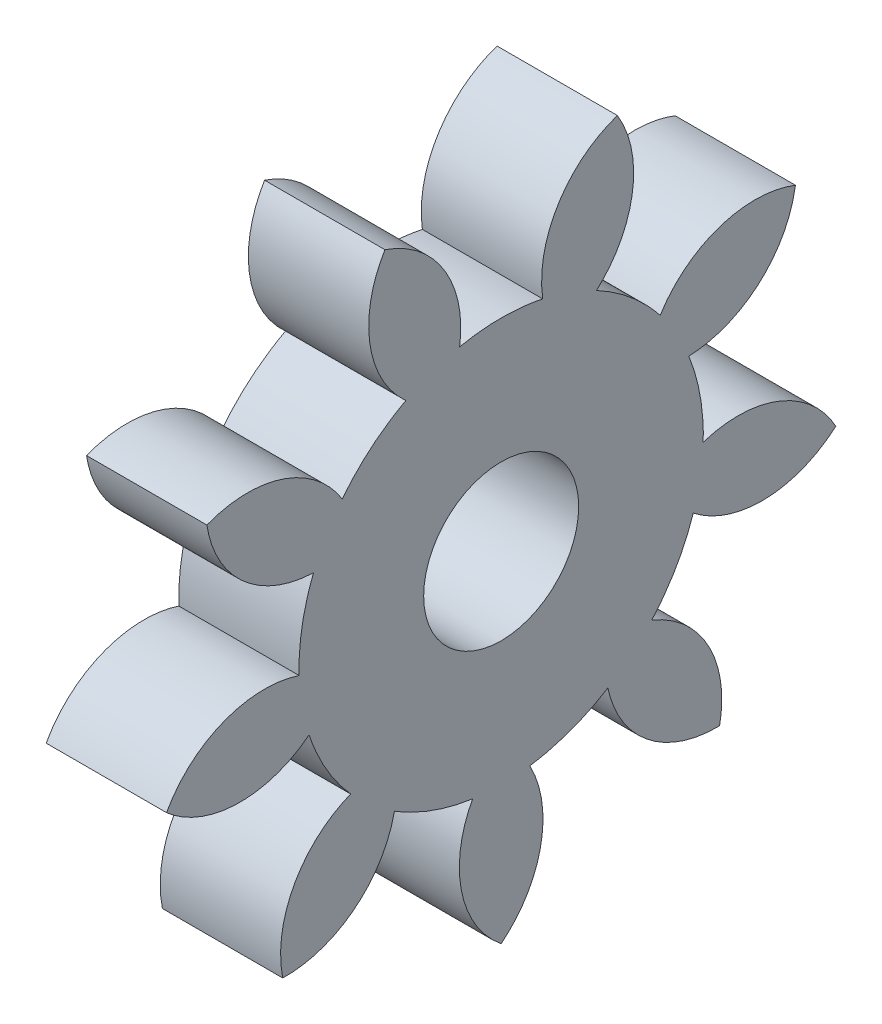
from build123d import *

# Parameters (mm, degrees)
BASPROSKE_W     = 3.175
BASPROSKE_H     = 6.985
TOOTHCUT_DEPTH  = 11.375985495
TEETHCUTS_COUNT = 9
BORSKE_R        = 1.5875
BORE_DEPTH      = 50.8000508
SCALE1_SCALE_X  = 1
SCALE1_SCALE_Y  = 1.288
SCALE1_SCALE_Z  = 1.288


with BuildPart() as part:
    # BasProSke → Base-Revolve (revolve)
    with BuildSketch(Plane(origin=(0, 0, 0), x_dir=(1, 0, 0), z_dir=(0, 1, 0)), mode=Mode.PRIVATE) as base_revolve_sk:
        with Locations((1.5875, 3.4925)):
            Rectangle(BASPROSKE_W, BASPROSKE_H)
    revolve(base_revolve_sk.sketch.rotate(Axis((-10, 0, 0), (1, 0, 0)), 180), axis=Axis((-10, 0, 0), (1, 0, 0)))

    # TooCutSke → ToothCut (cut, through all)
    with BuildSketch(Plane(origin=(0, 0, 0), x_dir=(0, 0, -1), z_dir=(1, 0, 0))):
        with BuildLine():
            ThreePointArc((0.85090004, 4.051817513), (0, 4.1402), (-0.85090004, 4.051817513))
            ThreePointArc((-0.85090004, 4.051817513), (-1.187930048, 5.606894235), (-2.458065659, 6.565334826))
            ThreePointArc((-2.458065659, 6.565334826), (0, 7.0104), (2.458065659, 6.565334826))
            ThreePointArc((2.458065659, 6.565334826), (1.187930048, 5.606894235), (0.85090004, 4.051817513))
        make_face()
    toothcut = extrude(amount=TOOTHCUT_DEPTH, mode=Mode.SUBTRACT)

    # TeethCuts: ToothCut ×9 about axis
    teethcuts_axis = Axis((-10, 0, 0), (1, 0, 0))
    for i in range(1, TEETHCUTS_COUNT):
        add(toothcut.rotate(teethcuts_axis, i * 360 / TEETHCUTS_COUNT), mode=Mode.SUBTRACT)

    # BorSke → Bore (cut, symmetric)
    with BuildSketch(Plane(origin=(0, 0, 0), x_dir=(0, 0, -1), z_dir=(1, 0, 0))):
        with Locations(Location((0, 0, 0), (0, 0, 180))):
            Circle(BORSKE_R)
    extrude(amount=BORE_DEPTH, both=True, mode=Mode.SUBTRACT)


with BuildPart() as part_1:
    # Scale1: scaled about (1.5875, 0, 0)
    add(part.part.scale((SCALE1_SCALE_X, SCALE1_SCALE_Y, SCALE1_SCALE_Z), about=(1.5875, 0, 0)))


solid = part_1.part
